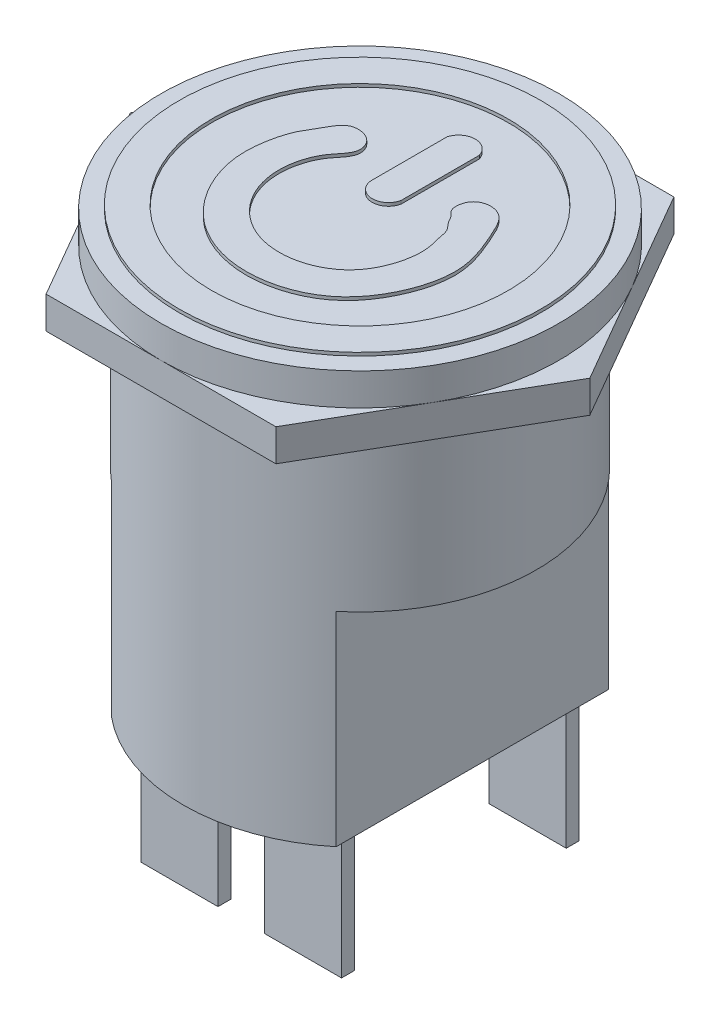
from build123d import *
from build123d.topology import SkipClean

# Parameters (mm, degrees)
SKETCH_1_R      = 11
EXTRUDE_1_DEPTH = 10
EXTRUDE_2_DEPTH = 2
SKETCH_3_R      = 12.4
EXTRUDE_3_DEPTH = 2
SKETCH_5_R      = 11.264641855
SKETCH_5_R_2    = 9.25178024
EXTRUDE_4_DEPTH = 0.2
EXTRUDE_START   = 12.7
SKETCH_6_W      = 14
SKETCH_6_H      = 16.970562748
EXTRUDE_5_DEPTH = 12.7
SKETCH_7_W      = 4.8
SKETCH_7_H      = 0.8
EXTRUDE_6_DEPTH = 8


with BuildPart() as part:
    # 草图1 → 凸台-拉伸1 (new body)
    with BuildSketch(Plane(origin=(0, 0, 0), x_dir=(1, 0, 0), z_dir=(0, 1, 0))):
        with Locations(Location((0, 0, 0), (0, 0, 270))):
            Circle(SKETCH_1_R)
    extrude(amount=EXTRUDE_1_DEPTH)

    # 草图2 → 凸台-拉伸2 (add)
    with BuildSketch(Plane(origin=(0, 10, 0), x_dir=(1, 0, 0), z_dir=(0, 1, 0))):
        Polygon((7.159143338, -12.4), (14.318286676, 0), (7.159143338, 12.4), (-7.159143338, 12.4), (-14.318286676, 0), (-7.159143338, -12.4), align=None)
    extrude(amount=EXTRUDE_2_DEPTH)

    # 草图3 → 凸台-拉伸3 (add)
    with BuildSketch(Plane(origin=(0, 12, 0), x_dir=(1, 0, 0), z_dir=(0, 1, 0))):
        with Locations(Location((0, 0, 0), (0, 0, 270))):
            Circle(SKETCH_3_R)
    extrude(amount=EXTRUDE_3_DEPTH)

    # 草图5 → 凸台-拉伸4 (add)
    # profile 1 of 3: a face of its own
    with BuildSketch(Plane(origin=(0, 14, 0), x_dir=(1, 0, 0), z_dir=(0, 1, 0))):
        with Locations(Location((0, 0, 0), (0, 0, 270))):
            Circle(SKETCH_5_R)
        with Locations(Location((0, 0, 0), (0, 0, 270))):
            Circle(SKETCH_5_R_2, mode=Mode.SUBTRACT)
    # profile 2 of 3: a face of its own
    with BuildSketch(Plane(origin=(0, 14, 0), x_dir=(1, 0, 0), z_dir=(0, 1, 0))):
        with BuildLine():
            add(Edge.make_bspline(
                [(-4.531930976, 3.945494062), (-4.931928742, 3.77750387), (-5.311682001, 2.960342277), (-5.991141543, 1.949169031), (-6.396271783, 0.524296362), (-6.537370068, -1.286255496), (-5.840461103, -3.78050422), (-3.973519682, -6.124461985), (-1.238390819, -7.169357291), (1.520794025, -7.173420809), (4.211359131, -6.084158365), (6.086695891, -3.477668911), (6.905357115, -0.367726074), (5.905130942, 2.059620867), (5.028765713, 3.962793153), (3.875298238, 4.041756072), (3.29141668, 3.696344725), (3.048713235, 3.141954909), (3.061357601, 2.526413251), (3.488195445, 2.234620856), (3.679341437, 1.769390855), (4.169012756, 1.362737183), (4.223062658, 0.659416394), (4.515624189, -0.227999974), (4.461264715, -1.369716105), (4.079353431, -2.593948769), (3.30330561, -3.914996189), (1.935894526, -4.815540791), (0.278175009, -5.149155893), (-1.219670545, -5.004826573), (-2.832376043, -4.211829708), (-4.044284214, -2.735827002), (-4.496323869, -0.944601433), (-4.311986077, 0.553939945), (-3.824616639, 1.652646984), (-3.227775265, 2.283187209), (-2.88981713, 2.939912012), (-3.127884309, 3.699186823), (-3.820836776, 4.050553792), (-4.341264245, 4.025569861), (-4.531930976, 3.945494062)],
                knots=[0, 0, 0, 0, 0.023973889, 0.04155419, 0.066468029, 0.100998981, 0.137141746, 0.20193186, 0.251863159, 0.287326725, 0.347456235, 0.39706454, 0.454431749, 0.507559151, 0.538353321, 0.553211894, 0.562961677, 0.572498599, 0.584637384, 0.591443225, 0.598437343, 0.610871675, 0.62326923, 0.634065974, 0.660780987, 0.681865173, 0.702097016, 0.741217122, 0.764094276, 0.791316499, 0.819614085, 0.857637757, 0.888785096, 0.915262001, 0.936720816, 0.951197394, 0.961514557, 0.974340001, 0.988572379, 1, 1, 1, 1], degree=3))
        make_face()
    # profile 3 of 3: a face of its own
    with BuildSketch(Plane(origin=(0, 14, 0), x_dir=(1, 0, 0), z_dir=(0, 1, 0))):
        with BuildLine():
            Line((-0.953053843, 6.387223198), (-0.953053843, 1.620615101))
            ThreePointArc((-0.953053843, 1.620615101), (0.003085924, 0.707999599), (1.047457876, 1.518158555))
            Line((1.047457876, 1.518158555), (1.047457876, 6.387223198))
            ThreePointArc((1.047457876, 6.387223198), (0.047202017, 7.135854771), (-0.953053843, 6.387223198))
        make_face()
    extrude(amount=EXTRUDE_4_DEPTH)

    # 草图6 → 凸台-拉伸5 (add)
    with SkipClean():  # the faces are left unmerged after this step: merging them gives an invalid solid
        with BuildSketch(Plane.XZ.offset(EXTRUDE_START)):
            Rectangle(SKETCH_6_W, SKETCH_6_H)
            with BuildLine():
                Line((-7, 8.485281374), (7, 8.485281374))
                ThreePointArc((7, 8.485281374), (0, 11), (-7, 8.485281374))
            make_face()
            with BuildLine():
                ThreePointArc((-7, -8.485281374), (0, -11), (7, -8.485281374))
                Line((7, -8.485281374), (-7, -8.485281374))
            make_face()
        extrude(amount=-EXTRUDE_5_DEPTH)

    # 草图7 → 凸台-拉伸6 (add)
    with SkipClean():  # the faces are left unmerged after this step: merging them gives an invalid solid
        with BuildSketch(Plane.XZ.offset(12.7)):
            with Locations((3.85, 7)):
                Rectangle(SKETCH_7_W, SKETCH_7_H)
            with Locations((-3.85, 7)):
                Rectangle(SKETCH_7_W, SKETCH_7_H)
            with Locations((3.85, -7)):
                Rectangle(SKETCH_7_W, SKETCH_7_H)
            with Locations((-3.85, -7)):
                Rectangle(SKETCH_7_W, SKETCH_7_H)
        extrude(amount=EXTRUDE_6_DEPTH)


solid = part.part
